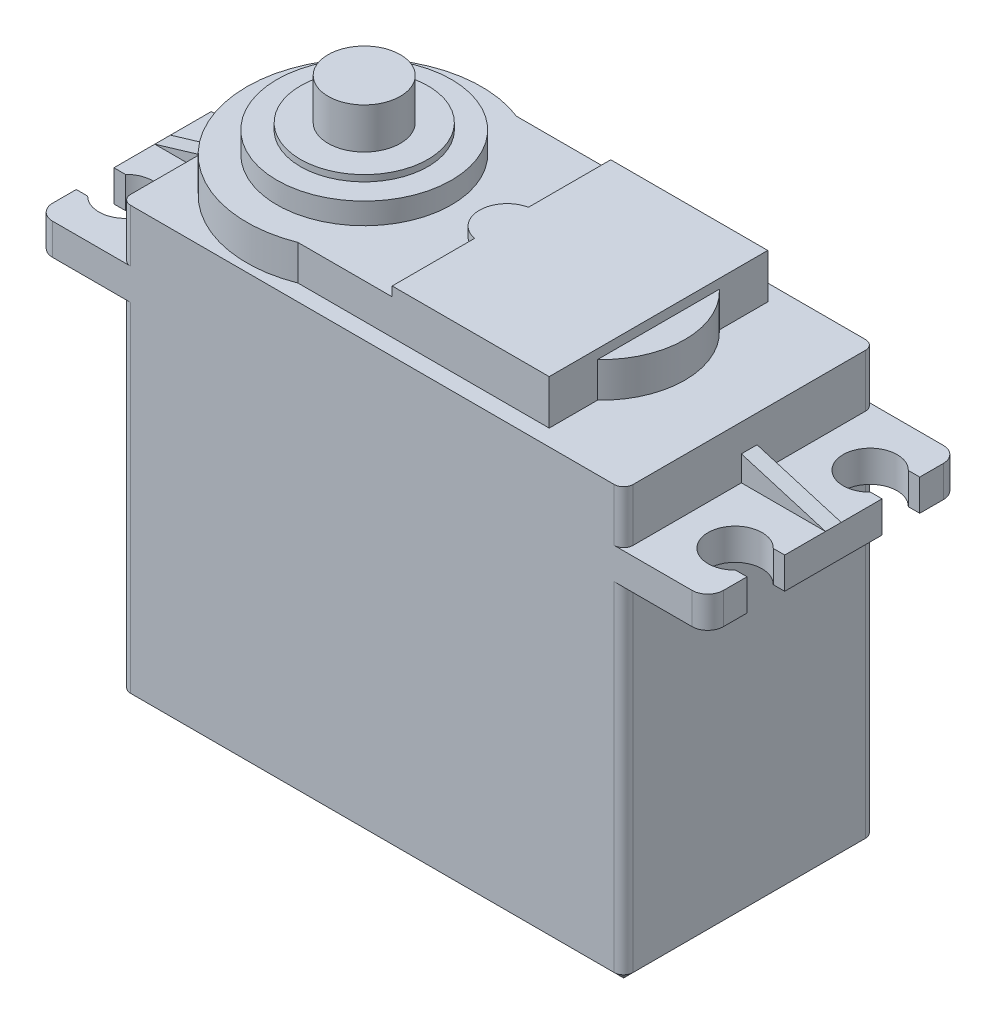
from build123d import *

# Parameters (mm, degrees)
SKETCH1_W                 = 40
SKETCH1_H                 = 20
BOSS_EXTRUDE1_DEPTH       = 34.4
BOSS_EXTRUDE2_DEPTH       = 2.8
SKETCH4_R                 = 6.95
BOSS_EXTRUDE3_DEPTH       = 1.7
SKETCH5_R                 = 5.075
BOSS_EXTRUDE4_DEPTH       = 0.5
SKETCH6_R                 = 2.875
BOSS_EXTRUDE5_DEPTH       = 3.25
BOSS_EXTRUDE6_DEPTH       = 0.75
SKETCH8_W                 = 20
SKETCH8_H                 = 2.5
BOSS_EXTRUDE7_DEPTH       = 6.7
SKETCH9_W                 = 20
SKETCH9_H                 = 2.5
BOSS_EXTRUDE8_DEPTH       = 6.7
CUT_EXTRUDE1_DEPTH        = 60.10101522
SKETCH11_W                = 6.15
SKETCH11_H                = 3.85
BOSS_EXTRUDE9_DEPTH       = 1
FILLET1_R                 = 0.75
FILLET2_R                 = 1.25
CHAMFER1_SIZE             = 0.75
BOSS_EXTRUDE10_DEPTH      = 0.625
BOSS_EXTRUDE10_DEPTH_BACK = 0.625


with BuildPart() as part:
    # Sketch1 → Boss-Extrude1 (new body)
    with BuildSketch(Plane(origin=(0, 0, 0), x_dir=(1, 0, 0), z_dir=(0, 1, 0))):
        with Locations((20, -10)):
            Rectangle(SKETCH1_W, SKETCH1_H)
    extrude(amount=BOSS_EXTRUDE1_DEPTH)

    # Sketch3 → Boss-Extrude2 (add)
    with BuildSketch(Plane(origin=(0, 34.4, 0), x_dir=(1, 0, 0), z_dir=(0, 1, 0))):
        with BuildLine():
            Line((12.775273712, -1.3), (32.775273712, -1.3))
            Line((32.775273712, -1.3), (32.775273712, -5.15))
            ThreePointArc((32.775273712, -5.15), (34.875273712, -10), (32.775273712, -14.85))
            Line((32.775273712, -14.85), (32.775273712, -18.7))
            Line((32.775273712, -18.7), (12.775273712, -18.7))
            ThreePointArc((12.775273712, -18.7), (0, -10), (12.775273712, -1.3))
        make_face()
    extrude(amount=BOSS_EXTRUDE2_DEPTH)

    # Sketch4 → Boss-Extrude3 (add)
    with BuildSketch(Plane(origin=(0, 37.2, 0), x_dir=(1, 0, 0), z_dir=(0, 1, 0))):
        with Locations(Location((9.35, -10, 0), (0, 0, 90))):
            Circle(SKETCH4_R)
    extrude(amount=BOSS_EXTRUDE3_DEPTH)

    # Sketch5 → Boss-Extrude4 (add)
    with BuildSketch(Plane(origin=(0, 38.9, 0), x_dir=(1, 0, 0), z_dir=(0, 1, 0))):
        with Locations(Location((9.35, -10, 0), (0, 0, 270))):
            Circle(SKETCH5_R)
    extrude(amount=BOSS_EXTRUDE4_DEPTH)

    # Sketch6 → Boss-Extrude5 (add)
    with BuildSketch(Plane(origin=(0, 39.4, 0), x_dir=(1, 0, 0), z_dir=(0, 1, 0))):
        with Locations(Location((9.35, -10, 0), (0, 0, 90))):
            Circle(SKETCH6_R)
    extrude(amount=BOSS_EXTRUDE5_DEPTH)

    # Sketch7 → Boss-Extrude6 (add)
    with BuildSketch(Plane(origin=(0, 37.2, 0), x_dir=(1, 0, 0), z_dir=(0, 1, 0))):
        with BuildLine():
            Line((32.775273712, -1.3), (32.775273712, -18.7))
            Line((32.775273712, -18.7), (20.275273712, -18.7))
            Line((20.275273712, -18.7), (20.275273712, -12.15))
            ThreePointArc((20.275273712, -12.15), (18.525273712, -10), (20.275273712, -7.85))
            Line((20.275273712, -7.85), (20.275273712, -1.3))
            Line((20.275273712, -1.3), (32.775273712, -1.3))
        make_face()
    extrude(amount=BOSS_EXTRUDE6_DEPTH)

    # Sketch8 → Boss-Extrude7 (add)
    with BuildSketch(Plane(origin=(40, 0, 0), x_dir=(0, 0, -1), z_dir=(1, 0, 0))):
        with Locations((-10, 28.95)):
            Rectangle(SKETCH8_W, SKETCH8_H)
    extrude(amount=BOSS_EXTRUDE7_DEPTH)

    # Sketch9 → Boss-Extrude8 (add)
    with BuildSketch(Plane.ZY):
        with Locations((10, 28.95)):
            Rectangle(SKETCH9_W, SKETCH9_H)
    extrude(amount=BOSS_EXTRUDE8_DEPTH)

    # Sketch10 → Cut-Extrude1 (cut, through all)
    with BuildSketch(Plane(origin=(0, 30.2, 0), x_dir=(1, 0, 0), z_dir=(0, 1, 0))):
        with BuildLine():
            Line((45.79029218, -3.125), (46.7, -3.125))
            Line((46.7, -3.125), (46.7, -6.125))
            Line((46.7, -6.125), (45.79029218, -6.125))
            ThreePointArc((45.79029218, -6.125), (42.1, -4.625), (45.79029218, -3.125))
        make_face()
        with BuildLine():
            Line((45.79029218, -13.875), (46.7, -13.875))
            Line((46.7, -13.875), (46.7, -16.875))
            Line((46.7, -16.875), (45.79029218, -16.875))
            ThreePointArc((45.79029218, -16.875), (42.1, -15.375), (45.79029218, -13.875))
        make_face()
        with BuildLine():
            Line((-5.79029218, -3.125), (-6.7, -3.125))
            Line((-6.7, -3.125), (-6.7, -6.125))
            Line((-6.7, -6.125), (-5.79029218, -6.125))
            ThreePointArc((-5.79029218, -6.125), (-2.1, -4.625), (-5.79029218, -3.125))
        make_face()
        with BuildLine():
            Line((-5.79029218, -13.875), (-6.7, -13.875))
            Line((-6.7, -13.875), (-6.7, -16.875))
            Line((-6.7, -16.875), (-5.79029218, -16.875))
            ThreePointArc((-5.79029218, -16.875), (-2.1, -15.375), (-5.79029218, -13.875))
        make_face()
    extrude(amount=-CUT_EXTRUDE1_DEPTH, mode=Mode.SUBTRACT)

    # Sketch11 → Boss-Extrude9 (add)
    with BuildSketch(Plane.ZY):
        with Locations((10, 1.925)):
            Rectangle(SKETCH11_W, SKETCH11_H)
    extrude(amount=BOSS_EXTRUDE9_DEPTH)

    # Fillet1
    fillet1_edges = [part.edges().sort_by_distance(p)[0] for p in [
        (40, 13.85, 0),
        (40, 13.85, 20),
        (0, 32.3, 0),
        (40, 32.3, 0),
        (40, 32.3, 20),
        (0, 13.85, 0),
        (0, 32.3, 20),
        (0, 13.85, 20),
    ]]
    fillet(fillet1_edges, radius=FILLET1_R)

    # Fillet2
    fillet2_edges = [part.edges().sort_by_distance(p)[0] for p in [
        (46.7, 28.95, 20),
        (46.7, 28.95, 0),
        (-6.7, 28.95, 0),
        (-6.7, 28.95, 20),
    ]]
    fillet(fillet2_edges, radius=FILLET2_R)

    # Chamfer1
    chamfer1_edges = [part.edges().sort_by_distance(p)[0] for p in [
        (0, 0, 16.1625),
        (0, 0, 3.8375),
        (20, 0, 0),
        (40, 0, 10),
        (20, 0, 20),
        (0.219669914, 0, 19.780330086),
        (39.780330086, 0, 19.780330086),
        (39.780330086, 0, 0.219669914),
        (0.219669914, 0, 0.219669914),
    ]]
    chamfer(chamfer1_edges, length=CHAMFER1_SIZE)

    # Sketch12 → Boss-Extrude10 (add, two sides: drawn at the far end of the back side and taken through both)
    with BuildSketch(Plane(origin=(0, 0, 10), x_dir=(-1, 0, 0), z_dir=(0, 0, -1)).offset(-BOSS_EXTRUDE10_DEPTH_BACK)):
        Polygon((-40, 32.2), (-46.7, 30.2), (-40, 30.2), align=None)
        Polygon((6.7, 30.2), (0, 32.2), (0, 30.2), align=None)
    extrude(amount=BOSS_EXTRUDE10_DEPTH + BOSS_EXTRUDE10_DEPTH_BACK)


solid = part.part
